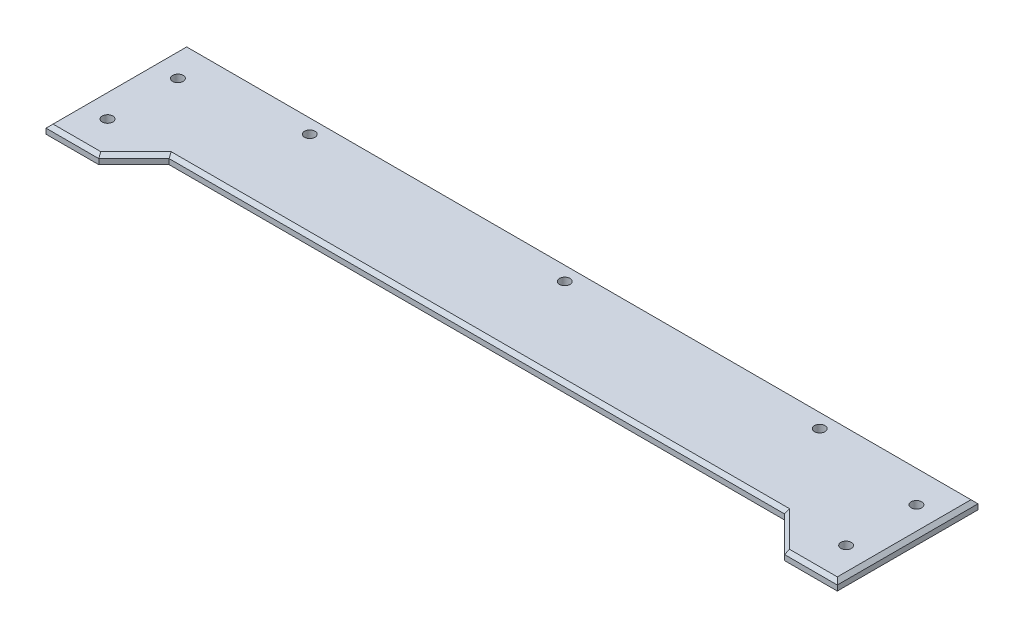
from build123d import *

# Parameters (mm, degrees)
CROQUIS1_R              = 3
SALIENTE_EXTRUIR1_DEPTH = 5
CHAFL_N1_SIZE           = 2


with BuildPart() as part:
    # Croquis1 → Saliente-Extruir1 (new body)
    with BuildSketch(Plane(origin=(0, 0, 0), x_dir=(1, 0, 0), z_dir=(0, 1, 0))):
        Polygon((-149.607843137, -39.607843137), (-129.607843137, -19.607843137), (220.392156863, -19.607843137), (240.392156863, -39.607843137), (270.392156863, -39.607843137), (270.392156863, 40.392156863), (-179.607843137, 40.392156863), (-179.607843137, -39.607843137), align=None)
        with Locations(Location((-164.607843137, 20.392156863, 0), (0, 0, 270))):
            Circle(CROQUIS1_R, mode=Mode.SUBTRACT)
        with Locations(Location((-99.607843137, 30.392156863, 0), (0, 0, 270))):
            Circle(CROQUIS1_R, mode=Mode.SUBTRACT)
        with Locations(Location((190.392156863, 30.392156863, 0), (0, 0, 270))):
            Circle(CROQUIS1_R, mode=Mode.SUBTRACT)
        with Locations(Location((45.392156863, 30.392156863, 0), (0, 0, 270))):
            Circle(CROQUIS1_R, mode=Mode.SUBTRACT)
        with Locations(Location((-164.607843137, -19.607843137, 0), (0, 0, 270))):
            Circle(CROQUIS1_R, mode=Mode.SUBTRACT)
        with Locations(Location((255.392156863, 20.392156863, 0), (0, 0, 270))):
            Circle(CROQUIS1_R, mode=Mode.SUBTRACT)
        with Locations(Location((255.392156863, -19.607843137, 0), (0, 0, 270))):
            Circle(CROQUIS1_R, mode=Mode.SUBTRACT)
    extrude(amount=SALIENTE_EXTRUIR1_DEPTH)

    # Chaflán1
    chafl_n1_edges = [part.edges().sort_by_distance(p)[0] for p in [
        (-139.607843137, 5, 29.607843137),
        (45.392156863, 5, 19.607843137),
        (230.392156863, 5, 29.607843137),
        (255.392156863, 5, 39.607843137),
        (270.392156863, 5, -0.392156863),
        (45.392156863, 5, -40.392156863),
        (-179.607843137, 5, -0.392156863),
        (-164.607843137, 5, 39.607843137),
    ]]
    chamfer(chafl_n1_edges, length=CHAFL_N1_SIZE)


solid = part.part
